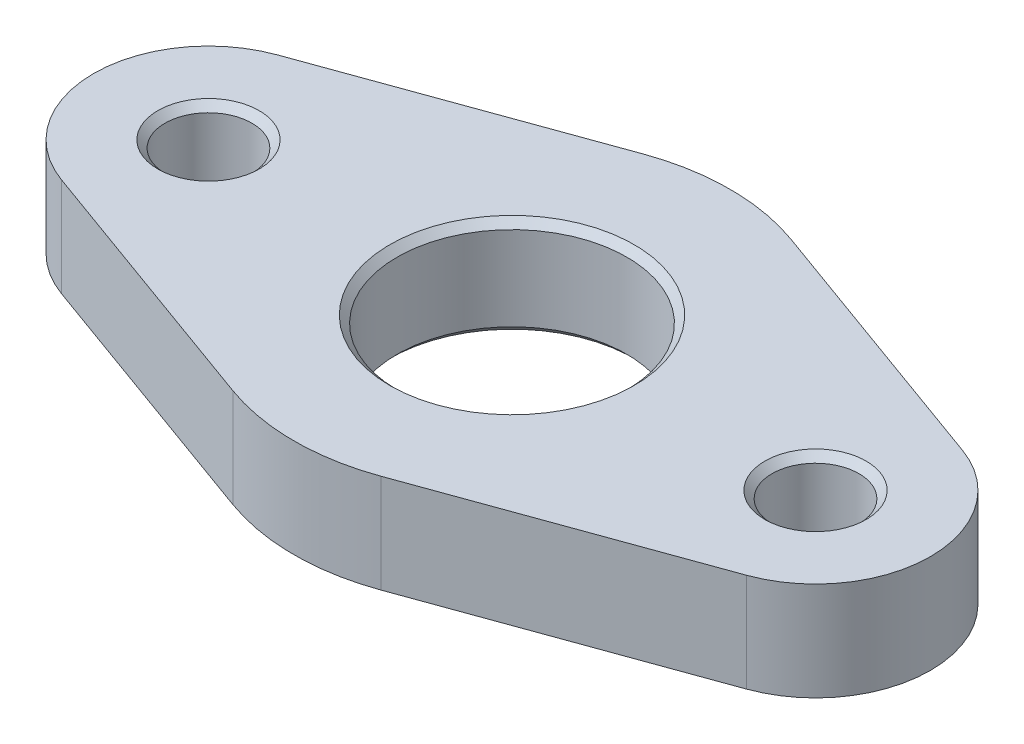
from build123d import *

# Parameters (mm, degrees)
BOSS_EXTRUDE1_DEPTH = 10.9
SKETCH3_R           = 12.7
SKETCH3_R_2         = 4.8
CUT_EXTRUDE1_DEPTH  = 10.9
CHAMFER1_SIZE       = 0.8
CHAMFER2_SIZE       = 0.8


with BuildPart() as part:
    # Sketch1 → Boss-Extrude1 (new body)
    with BuildSketch(Plane(origin=(0, 0, 0), x_dir=(1, 0, 0), z_dir=(0, 1, 0))):
        with BuildLine():
            Line((-37.865350224, 11.944360697), (-8.188971684, 22.666070298))
            ThreePointArc((-8.188971684, 22.666070298), (0, 24.1), (8.188971684, 22.666070298))
            Line((8.188971684, 22.666070298), (37.865350224, 11.944360697))
            ThreePointArc((37.865350224, 11.944360697), (46.25, 0), (37.865350224, -11.944360697))
            Line((37.865350224, -11.944360697), (8.188971684, -22.666070298))
            ThreePointArc((8.188971684, -22.666070298), (0, -24.1), (-8.188971684, -22.666070298))
            Line((-8.188971684, -22.666070298), (-37.865350224, -11.944360697))
            ThreePointArc((-37.865350224, -11.944360697), (-46.25, 0), (-37.865350224, 11.944360697))
        make_face()
    extrude(amount=BOSS_EXTRUDE1_DEPTH)

    # Sketch3 → Cut-Extrude1 (cut)
    with BuildSketch(Plane(origin=(0, 10.9, 0), x_dir=(1, 0, 0), z_dir=(0, 1, 0))):
        with Locations(Location((0, 0, 0), (0, 0, 270))):
            Circle(SKETCH3_R)
        with Locations(Location((-33.55, 0, 0), (0, 0, 270))):
            Circle(SKETCH3_R_2)
        with Locations(Location((33.55, 0, 0), (0, 0, 90))):
            Circle(SKETCH3_R_2)
    extrude(amount=-CUT_EXTRUDE1_DEPTH, mode=Mode.SUBTRACT)

    # Chamfer1
    chamfer1_edges = [part.edges().sort_by_distance(p)[0] for p in [
        (33.55, 10.9, 4.8),
        (-33.55, 10.9, -4.8),
        (0, 10.9, -12.7),
    ]]
    chamfer(chamfer1_edges, length=CHAMFER1_SIZE)

    # Chamfer2
    chamfer2_edges = [part.edges().sort_by_distance(p)[0] for p in [
        (33.55, 0, 4.8),
        (-33.55, 0, -4.8),
        (0, 0, -12.7),
    ]]
    chamfer(chamfer2_edges, length=CHAMFER2_SIZE)


solid = part.part
